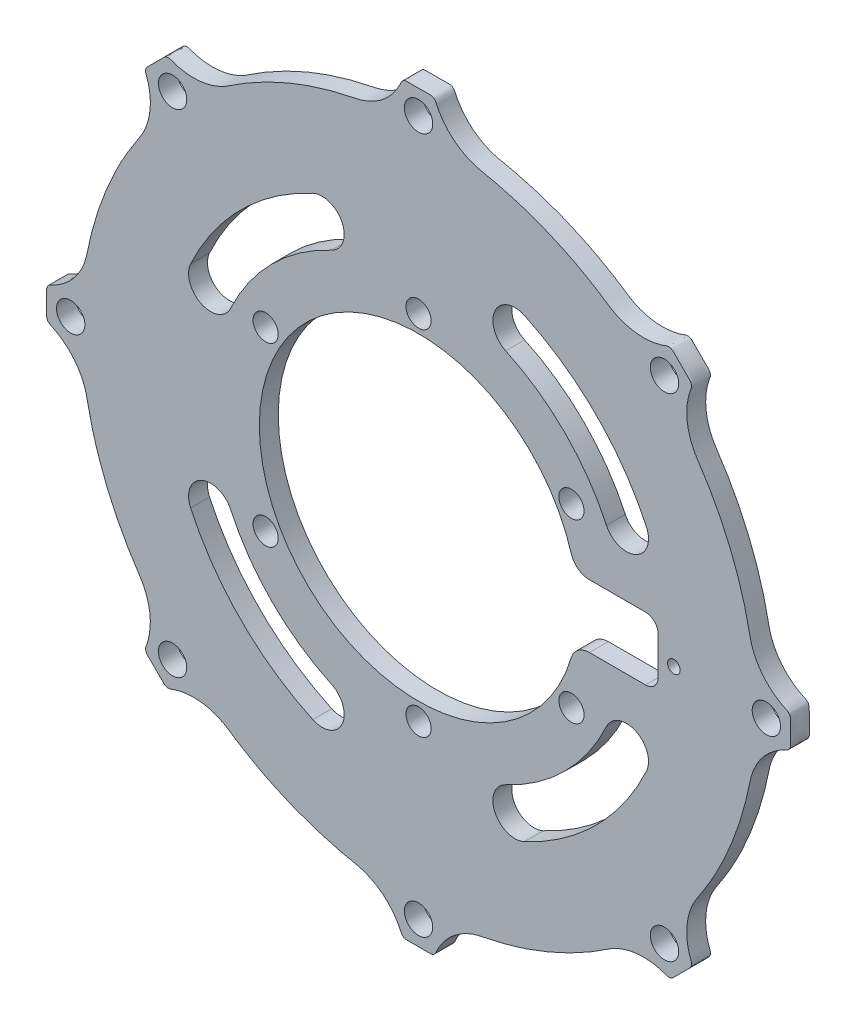
from build123d import *

# Parameters (mm, degrees)
SKETCH1_R                 = 1
BOSS_EXTRUDE1_DEPTH       = 3
F_4_0MM_DOWEL_HOLE1_D     = 4
F_4_0MM_DOWEL_HOLE1_DEPTH = 4
F_4_0MM_DOWEL_HOLE1_TIP   = 1.201721238
M4_CLEARANCE_HOLE1_D      = 4.5
M4_CLEARANCE_HOLE1_DEPTH  = 4
M4_CLEARANCE_HOLE1_TIP    = 1.351936393
SKETCH16_R                = 46.9
SKETCH16_R_2              = 45.6
BOSS_EXTRUDE2_DEPTH       = 1.35


with BuildPart() as part:
    # Sketch1 → Boss-Extrude1 (new body)
    with BuildSketch(Plane.XY):
        with BuildLine():
            add(Edge.make_bspline(
                [(-2.888569338, 58.090305414), (-3.904277799, 55.9452699), (-5.591838924, 54.27644442), (-7.748079959, 53.284746062), (-8.235225684, 53.060698004), (-9.245557382, 52.690963884), (-10.84227328, 52.398071486), (-11.889156148, 52.164983222), (-12.410727624, 52.040597997), (-17.936005436, 50.722920633), (-23.183850069, 48.549192213), (-28.022550078, 45.573969403), (-28.479310442, 45.293116312), (-29.384386709, 44.717676629), (-30.720541549, 43.79573419), (-31.696395448, 43.342763299), (-32.199285394, 43.156725154), (-34.52028494, 42.298099023), (-36.994919588, 42.319571853), (-39.300669877, 43.218345087), (-39.301071956, 43.218501816), (-39.301876093, 43.218815326), (-39.303082259, 43.219285695), (-39.303886295, 43.219599465), (-39.304288312, 43.21975635), (-39.304689349, 43.219912852), (-39.305491422, 43.220225856), (-39.306694532, 43.220695362), (-39.307496605, 43.221008367), (-39.307897642, 43.221164869), (-39.310303861, 43.222103881), (-39.31271008, 43.223042894), (-39.3151163, 43.223981906), (-39.315517337, 43.224138408), (-39.31631941, 43.224451412), (-39.317522519, 43.224920919), (-39.318324593, 43.225233923), (-39.318725629, 43.225390425), (-39.319128068, 43.225547474), (-39.319932946, 43.225861573), (-39.321141382, 43.226329852), (-39.321947274, 43.226641342), (-39.32235032, 43.226796825), (-39.599832465, 43.333841276), (-39.896638588, 43.314841774), (-40.158207362, 43.173290965), (-40.186385644, 43.158041979), (-40.241276486, 43.124835529), (-40.32140827, 43.068886213), (-40.366719354, 43.023575129), (-40.389374896, 43.000919586), (-40.412030438, 42.978264044), (-40.457341522, 42.93295296), (-40.525308148, 42.864986334), (-40.570619233, 42.81967525), (-40.593274775, 42.797019708), (-41.327856419, 42.062438063), (-42.062438063, 41.327856419), (-42.797019708, 40.593274775), (-42.81967525, 40.570619233), (-42.864986334, 40.525308148), (-42.93295296, 40.457341522), (-42.978264044, 40.412030438), (-43.000919586, 40.389374896), (-43.023575129, 40.366719354), (-43.068886213, 40.32140827), (-43.124835529, 40.241276486), (-43.158041979, 40.186385644), (-43.173290965, 40.158207362), (-43.314841774, 39.896638588), (-43.333841276, 39.599832465), (-43.226796825, 39.32235032), (-43.226641342, 39.321947274), (-43.226329852, 39.321141382), (-43.225861573, 39.319932946), (-43.225547474, 39.319128068), (-43.225390425, 39.318725629), (-43.225233923, 39.318324593), (-43.224920919, 39.317522519), (-43.224451412, 39.31631941), (-43.224138408, 39.315517337), (-43.223981906, 39.3151163), (-43.223042894, 39.31271008), (-43.222103881, 39.310303861), (-43.221164869, 39.307897642), (-43.221008367, 39.307496605), (-43.220695362, 39.306694532), (-43.220225856, 39.305491422), (-43.219912852, 39.304689349), (-43.21975635, 39.304288312), (-43.219599465, 39.303886294), (-43.219285695, 39.303082259), (-43.218815326, 39.301876093), (-43.218501816, 39.301071956), (-43.218345087, 39.300669877), (-42.319571853, 36.994919588), (-42.298099023, 34.52028494), (-43.156725154, 32.199285394), (-43.342763299, 31.696395448), (-43.79573419, 30.720541549), (-44.717676629, 29.384386709), (-45.293116312, 28.479310442), (-45.573969403, 28.022550078), (-48.549192213, 23.183850069), (-50.722920633, 17.936005436), (-52.040597997, 12.410727624), (-52.164983222, 11.889156148), (-52.398071486, 10.84227328), (-52.690963884, 9.245557382), (-53.060698004, 8.235225684), (-53.284746062, 7.748079959), (-54.31880022, 5.499745081), (-56.083814744, 3.765097724), (-58.349755058, 2.770214708), (-58.350150195, 2.770041219), (-58.350940491, 2.769694293), (-58.35212598, 2.769174006), (-58.352916388, 2.768827336), (-58.353311592, 2.768654001), (-58.353705831, 2.768481089), (-58.35449431, 2.768135265), (-58.355677028, 2.767616529), (-58.356465507, 2.767270705), (-58.356859746, 2.767097793), (-58.359225182, 2.766060321), (-58.361590618, 2.765022849), (-58.363956055, 2.763985377), (-58.364350294, 2.763812465), (-58.365138773, 2.763466641), (-58.366321491, 2.762947905), (-58.367109969, 2.762602081), (-58.367504209, 2.762429169), (-58.367899827, 2.762255652), (-58.368691063, 2.761908619), (-58.36987668, 2.761385249), (-58.370666787, 2.761035654), (-58.371061728, 2.7608606), (-58.642963091, 2.640342951), (-58.839402036, 2.417034653), (-58.924267553, 2.131986062), (-58.933409946, 2.101278346), (-58.948743127, 2.038984153), (-58.965842714, 1.942760285), (-58.965842714, 1.878680735), (-58.965842714, 1.84664096), (-58.965842714, 1.814601185), (-58.965842714, 1.750521635), (-58.965842714, 1.654402311), (-58.965842714, 1.590322761), (-58.965842714, 1.558282986), (-58.965842714, 0.519427662), (-58.965842714, -0.519427662), (-58.965842714, -1.558282986), (-58.965842714, -1.590322761), (-58.965842714, -1.654402311), (-58.965842714, -1.750521635), (-58.965842714, -1.814601185), (-58.965842714, -1.84664096), (-58.965842714, -1.878680735), (-58.965842714, -1.942760285), (-58.948743127, -2.038984153), (-58.933409946, -2.101278346), (-58.924267553, -2.131986062), (-58.839402036, -2.417034653), (-58.642963091, -2.640342951), (-58.371061728, -2.7608606), (-58.370666787, -2.761035654), (-58.36987668, -2.761385249), (-58.368691063, -2.761908619), (-58.367899827, -2.762255652), (-58.367504209, -2.762429169), (-58.367109969, -2.762602081), (-58.366321491, -2.762947905), (-58.365138773, -2.763466641), (-58.364350294, -2.763812465), (-58.363956055, -2.763985377), (-58.361590618, -2.765022849), (-58.359225182, -2.766060321), (-58.356859746, -2.767097793), (-58.356465507, -2.767270705), (-58.355677028, -2.767616529), (-58.35449431, -2.768135265), (-58.353705831, -2.768481089), (-58.353311592, -2.768654001), (-58.352916388, -2.768827336), (-58.35212598, -2.769174006), (-58.350940491, -2.769694293), (-58.350150195, -2.770041219), (-58.349755058, -2.770214708), (-56.083814744, -3.765097724), (-54.31880022, -5.499745081), (-53.284746062, -7.748079959), (-53.060698004, -8.235225684), (-52.690963884, -9.245557382), (-52.398071486, -10.84227328), (-52.164983222, -11.889156148), (-52.040597997, -12.410727624), (-50.722920633, -17.936005436), (-48.549192213, -23.183850069), (-45.573969403, -28.022550078), (-45.293116312, -28.479310442), (-44.717676629, -29.384386709), (-43.79573419, -30.720541549), (-43.342763299, -31.696395448), (-43.156725154, -32.199285394), (-42.298099023, -34.52028494), (-42.319571853, -36.994919588), (-43.218345087, -39.300669877), (-43.218501816, -39.301071956), (-43.218815326, -39.301876093), (-43.219285695, -39.303082259), (-43.219599465, -39.303886294), (-43.21975635, -39.304288312), (-43.219912852, -39.304689349), (-43.220225856, -39.305491422), (-43.220695362, -39.306694532), (-43.221008367, -39.307496605), (-43.221164869, -39.307897642), (-43.222103881, -39.310303861), (-43.223042894, -39.31271008), (-43.223981906, -39.3151163), (-43.224138408, -39.315517337), (-43.224451412, -39.31631941), (-43.224920919, -39.317522519), (-43.225233923, -39.318324593), (-43.225390425, -39.318725629), (-43.225547474, -39.319128068), (-43.225861573, -39.319932946), (-43.226329852, -39.321141382), (-43.226641342, -39.321947274), (-43.226796825, -39.32235032), (-43.333841276, -39.599832465), (-43.314841774, -39.896638588), (-43.173290965, -40.158207362), (-43.158041979, -40.186385644), (-43.124835529, -40.241276486), (-43.068886213, -40.32140827), (-43.023575129, -40.366719354), (-43.000919586, -40.389374896), (-42.978264044, -40.412030438), (-42.93295296, -40.457341522), (-42.864986334, -40.525308148), (-42.81967525, -40.570619233), (-42.797019708, -40.593274775), (-42.062438063, -41.327856419), (-41.327856419, -42.062438063), (-40.593274775, -42.797019708), (-40.570619233, -42.81967525), (-40.525308148, -42.864986334), (-40.457341522, -42.93295296), (-40.412030438, -42.978264044), (-40.389374896, -43.000919586), (-40.366719354, -43.023575129), (-40.32140827, -43.068886213), (-40.241276486, -43.124835529), (-40.186385644, -43.158041979), (-40.158207362, -43.173290965), (-39.896638588, -43.314841774), (-39.599832465, -43.333841276), (-39.32235032, -43.226796825), (-39.321947274, -43.226641342), (-39.321141382, -43.226329852), (-39.319932946, -43.225861573), (-39.319128068, -43.225547474), (-39.318725629, -43.225390425), (-39.318324593, -43.225233923), (-39.317522519, -43.224920919), (-39.31631941, -43.224451412), (-39.315517337, -43.224138408), (-39.3151163, -43.223981906), (-39.31271008, -43.223042894), (-39.310303861, -43.222103881), (-39.307897642, -43.221164869), (-39.307496605, -43.221008367), (-39.306694532, -43.220695362), (-39.305491422, -43.220225856), (-39.304689349, -43.219912852), (-39.304288312, -43.21975635), (-39.303886294, -43.219599465), (-39.303082259, -43.219285695), (-39.301876093, -43.218815326), (-39.301071956, -43.218501816), (-39.300669877, -43.218345087), (-36.994919588, -42.319571853), (-34.52028494, -42.298099023), (-32.199285394, -43.156725154), (-31.696395448, -43.342763299), (-30.720541549, -43.79573419), (-29.384386709, -44.717676629), (-28.479310442, -45.293116312), (-28.022550078, -45.573969403), (-23.183850069, -48.549192213), (-17.936005436, -50.722920633), (-12.410727624, -52.040597997), (-11.889156148, -52.164983222), (-10.84227328, -52.398071486), (-9.245557382, -52.690963884), (-8.235225684, -53.060698004), (-7.748079959, -53.284746062), (-5.499745081, -54.31880022), (-3.765097724, -56.083814744), (-2.770214708, -58.349755058), (-2.770041219, -58.350150195), (-2.769694293, -58.350940491), (-2.769174006, -58.35212598), (-2.768827336, -58.352916388), (-2.768654001, -58.353311592), (-2.768481089, -58.353705831), (-2.768135265, -58.35449431), (-2.767616529, -58.355677028), (-2.767270705, -58.356465507), (-2.767097793, -58.356859746), (-2.766060321, -58.359225182), (-2.765022849, -58.361590618), (-2.763985377, -58.363956055), (-2.763812465, -58.364350294), (-2.763466641, -58.365138773), (-2.762947905, -58.366321491), (-2.762602081, -58.367109969), (-2.762429169, -58.367504209), (-2.762255652, -58.367899827), (-2.761908619, -58.368691063), (-2.761385249, -58.36987668), (-2.761035654, -58.370666787), (-2.7608606, -58.371061728), (-2.640342951, -58.642963091), (-2.417034653, -58.839402036), (-2.131986062, -58.924267553), (-2.101278346, -58.933409946), (-2.038984153, -58.948743127), (-1.942760285, -58.965842714), (-1.878680735, -58.965842714), (-1.84664096, -58.965842714), (-1.814601185, -58.965842714), (-1.750521635, -58.965842714), (-1.654402311, -58.965842714), (-1.590322761, -58.965842714), (-1.558282986, -58.965842714), (-0.519427662, -58.965842714), (0.519427662, -58.965842714), (1.558282986, -58.965842714), (1.590322761, -58.965842714), (1.654402311, -58.965842714), (1.750521635, -58.965842714), (1.814601185, -58.965842714), (1.84664096, -58.965842714), (1.878680735, -58.965842714), (1.942760285, -58.965842714), (2.038984153, -58.948743127), (2.101278346, -58.933409946), (2.131986062, -58.924267553), (2.417034653, -58.839402036), (2.640342951, -58.642963091), (2.7608606, -58.371061728), (2.761035654, -58.370666787), (2.761385249, -58.36987668), (2.761908619, -58.368691063), (2.762255652, -58.367899827), (2.762429169, -58.367504209), (2.762602081, -58.367109969), (2.762947905, -58.366321491), (2.763466641, -58.365138773), (2.763812465, -58.364350294), (2.763985377, -58.363956055), (2.765022849, -58.361590618), (2.766060321, -58.359225182), (2.767097793, -58.356859746), (2.767270705, -58.356465507), (2.767616529, -58.355677028), (2.768135265, -58.35449431), (2.768481089, -58.353705831), (2.768654001, -58.353311592), (2.768827336, -58.352916388), (2.769174006, -58.35212598), (2.769694293, -58.350940491), (2.770041219, -58.350150195), (2.770214708, -58.349755058), (3.765097724, -56.083814744), (5.499745081, -54.31880022), (7.748079959, -53.284746062), (8.235225684, -53.060698004), (9.245557382, -52.690963884), (10.84227328, -52.398071486), (11.889156148, -52.164983222), (12.410727624, -52.040597997), (17.936005436, -50.722920633), (23.183850069, -48.549192213), (28.022550078, -45.573969403), (28.479310442, -45.293116312), (29.384386709, -44.717676629), (30.720541549, -43.79573419), (31.696395448, -43.342763299), (32.199285394, -43.156725154), (34.52028494, -42.298099023), (36.994919588, -42.319571853), (39.300669877, -43.218345087), (39.301071956, -43.218501816), (39.301876093, -43.218815326), (39.303082259, -43.219285695), (39.303886294, -43.219599465), (39.304288312, -43.21975635), (39.304689349, -43.219912852), (39.305491422, -43.220225856), (39.306694532, -43.220695362), (39.307496605, -43.221008367), (39.307897642, -43.221164869), (39.310303861, -43.222103881), (39.31271008, -43.223042894), (39.3151163, -43.223981906), (39.315517337, -43.224138408), (39.31631941, -43.224451412), (39.317522519, -43.224920919), (39.318324593, -43.225233923), (39.318725629, -43.225390425), (39.319128068, -43.225547474), (39.319932946, -43.225861573), (39.321141382, -43.226329852), (39.321947274, -43.226641342), (39.32235032, -43.226796825), (39.599832465, -43.333841276), (39.896638588, -43.314841774), (40.158207362, -43.173290965), (40.186385644, -43.158041979), (40.241276486, -43.124835529), (40.32140827, -43.068886213), (40.366719354, -43.023575129), (40.389374896, -43.000919586), (40.412030438, -42.978264044), (40.457341522, -42.93295296), (40.525308148, -42.864986334), (40.570619233, -42.81967525), (40.593274775, -42.797019708), (41.327856419, -42.062438063), (42.062438063, -41.327856419), (42.797019708, -40.593274775), (42.81967525, -40.570619233), (42.864986334, -40.525308148), (42.93295296, -40.457341522), (42.978264044, -40.412030438), (43.000919586, -40.389374896), (43.023575129, -40.366719354), (43.068886213, -40.32140827), (43.124835529, -40.241276486), (43.158041979, -40.186385644), (43.173290965, -40.158207362), (43.314841774, -39.896638588), (43.333841276, -39.599832465), (43.226796825, -39.32235032), (43.226641342, -39.321947274), (43.226329852, -39.321141382), (43.225861573, -39.319932946), (43.225547474, -39.319128068), (43.225390425, -39.318725629), (43.225233923, -39.318324593), (43.224920919, -39.317522519), (43.224451412, -39.31631941), (43.224138408, -39.315517337), (43.223981906, -39.3151163), (43.223042894, -39.31271008), (43.222103881, -39.310303861), (43.221164869, -39.307897642), (43.221008367, -39.307496605), (43.220695362, -39.306694532), (43.220225856, -39.305491422), (43.219912852, -39.304689349), (43.21975635, -39.304288312), (43.219599465, -39.303886294), (43.219285695, -39.303082259), (43.218815326, -39.301876093), (43.218501816, -39.301071956), (43.218345087, -39.300669877), (42.319571853, -36.994919588), (42.298099023, -34.52028494), (43.156725154, -32.199285394), (43.342763299, -31.696395448), (43.79573419, -30.720541549), (44.717676629, -29.384386709), (45.293116312, -28.479310442), (45.573969403, -28.022550078), (48.549192213, -23.183850069), (50.722920633, -17.936005436), (52.040597997, -12.410727624), (52.164983222, -11.889156148), (52.398071486, -10.84227328), (52.690963884, -9.245557382), (53.060698004, -8.235225684), (53.284746062, -7.748079959), (54.31880022, -5.499745081), (56.083814744, -3.765097724), (58.349755058, -2.770214708), (58.350150195, -2.770041219), (58.350940491, -2.769694293), (58.35212598, -2.769174006), (58.352916388, -2.768827336), (58.353311592, -2.768654001), (58.353705831, -2.768481089), (58.35449431, -2.768135265), (58.355677028, -2.767616529), (58.356465507, -2.767270705), (58.356859746, -2.767097793), (58.359225182, -2.766060321), (58.361590618, -2.765022849), (58.363956055, -2.763985377), (58.364350294, -2.763812465), (58.365138773, -2.763466641), (58.366321491, -2.762947905), (58.367109969, -2.762602081), (58.367504209, -2.762429169), (58.367899827, -2.762255652), (58.368691063, -2.761908619), (58.36987668, -2.761385249), (58.370666787, -2.761035654), (58.371061728, -2.7608606), (58.642963091, -2.640342951), (58.839402036, -2.417034653), (58.924267553, -2.131986062), (58.933409946, -2.101278346), (58.948743127, -2.038984153), (58.965842714, -1.942760285), (58.965842714, -1.878680735), (58.965842714, -1.84664096), (58.965842714, -1.814601185), (58.965842714, -1.750521635), (58.965842714, -1.654402311), (58.965842714, -1.590322761), (58.965842714, -1.558282986), (58.965842714, -0.519427662), (58.965842714, 0.519427662), (58.965842714, 1.558282986), (58.965842714, 1.590322761), (58.965842714, 1.654402311), (58.965842714, 1.750521635), (58.965842714, 1.814601185), (58.965842714, 1.84664096), (58.965842714, 1.878680735), (58.965842714, 1.942760285), (58.948743127, 2.038984153), (58.933409946, 2.101278346), (58.924267553, 2.131986062), (58.839402036, 2.417034653), (58.642963091, 2.640342951), (58.371061728, 2.7608606), (58.370666787, 2.761035654), (58.36987668, 2.761385249), (58.368691063, 2.761908619), (58.367899827, 2.762255652), (58.367504209, 2.762429169), (58.367109969, 2.762602081), (58.366321491, 2.762947905), (58.365138773, 2.763466641), (58.364350294, 2.763812465), (58.363956055, 2.763985377), (58.361590618, 2.765022849), (58.359225182, 2.766060321), (58.356859746, 2.767097793), (58.356465507, 2.767270705), (58.355677028, 2.767616529), (58.35449431, 2.768135265), (58.353705831, 2.768481089), (58.353311592, 2.768654001), (58.352916388, 2.768827336), (58.35212598, 2.769174006), (58.350940491, 2.769694293), (58.350150195, 2.770041219), (58.349755058, 2.770214708), (56.083814744, 3.765097724), (54.31880022, 5.499745081), (53.284746062, 7.748079959), (53.060698004, 8.235225684), (52.690963884, 9.245557382), (52.398071486, 10.84227328), (52.164983222, 11.889156148), (52.040597997, 12.410727624), (50.722920633, 17.936005436), (48.549192213, 23.183850069), (45.573969403, 28.022550078), (45.293116312, 28.479310442), (44.717676629, 29.384386709), (43.79573419, 30.720541549), (43.342763299, 31.696395448), (43.156725154, 32.199285394), (42.298099023, 34.52028494), (42.319571853, 36.994919588), (43.218345087, 39.300669877), (43.218501816, 39.301071956), (43.218815326, 39.301876093), (43.219285695, 39.303082259), (43.219599465, 39.303886294), (43.21975635, 39.304288312), (43.219912852, 39.304689349), (43.220225856, 39.305491422), (43.220695362, 39.306694532), (43.221008367, 39.307496605), (43.221164869, 39.307897642), (43.222103881, 39.310303861), (43.223042894, 39.31271008), (43.223981906, 39.3151163), (43.224138408, 39.315517337), (43.224451412, 39.31631941), (43.224920919, 39.317522519), (43.225233923, 39.318324593), (43.225390425, 39.318725629), (43.225547474, 39.319128068), (43.225861573, 39.319932946), (43.226329852, 39.321141382), (43.226641342, 39.321947274), (43.226796825, 39.32235032), (43.333841276, 39.599832465), (43.314841774, 39.896638588), (43.173290965, 40.158207362), (43.158041979, 40.186385644), (43.124835529, 40.241276486), (43.068886213, 40.32140827), (43.023575129, 40.366719354), (43.000919586, 40.389374896), (42.978264044, 40.412030438), (42.93295296, 40.457341522), (42.864986334, 40.525308148), (42.81967525, 40.570619233), (42.797019708, 40.593274775), (42.062438063, 41.327856419), (41.327856419, 42.062438063), (40.593274775, 42.797019708), (40.570619233, 42.81967525), (40.525308148, 42.864986334), (40.457341522, 42.93295296), (40.412030438, 42.978264044), (40.389374896, 43.000919586), (40.366719354, 43.023575129), (40.32140827, 43.068886213), (40.241276486, 43.124835529), (40.186385644, 43.158041979), (40.158207362, 43.173290965), (39.896638588, 43.314841774), (39.599832465, 43.333841276), (39.32235032, 43.226796825), (39.321947274, 43.226641342), (39.321141382, 43.226329852), (39.319932946, 43.225861573), (39.319128068, 43.225547474), (39.318725629, 43.225390425), (39.318324593, 43.225233923), (39.317522519, 43.224920919), (39.31631941, 43.224451412), (39.315517337, 43.224138408), (39.3151163, 43.223981906), (39.31271008, 43.223042894), (39.310303861, 43.222103881), (39.307897642, 43.221164869), (39.307496605, 43.221008367), (39.306694532, 43.220695362), (39.305491422, 43.220225856), (39.304689349, 43.219912852), (39.304288312, 43.21975635), (39.303886294, 43.219599465), (39.303082259, 43.219285695), (39.301876093, 43.218815326), (39.301071956, 43.218501816), (39.300669877, 43.218345087), (36.994919588, 42.319571853), (34.52028494, 42.298099023), (32.199285394, 43.156725154), (31.696395448, 43.342763299), (30.720541549, 43.79573419), (29.384386709, 44.717676629), (28.479310442, 45.293116312), (28.022550078, 45.573969403), (23.183850069, 48.549192213), (17.936005436, 50.722920633), (12.410727624, 52.040597997), (11.889156148, 52.164983222), (10.84227328, 52.398071486), (9.245557382, 52.690963884), (8.235225684, 53.060698004), (7.748079959, 53.284746062), (5.591838924, 54.27644442), (3.904277799, 55.9452699), (2.888569338, 58.090305414), (2.86043616, 58.149718786), (2.805341513, 58.269100351), (2.727304111, 58.453248868), (2.652227716, 58.561956296), (2.609742987, 58.612120747), (2.483296792, 58.761423899), (2.319504695, 58.868438946), (2.131986062, 58.924267553), (2.101278346, 58.933409946), (2.038984153, 58.948743127), (1.942760285, 58.965842714), (1.878680735, 58.965842714), (1.84664096, 58.965842714), (1.814601185, 58.965842714), (1.750521635, 58.965842714), (1.654402311, 58.965842714), (1.590322761, 58.965842714), (1.558282986, 58.965842714), (0.519427662, 58.965842714), (-0.519427662, 58.965842714), (-1.558282986, 58.965842714), (-1.590322761, 58.965842714), (-1.654402311, 58.965842714), (-1.750521635, 58.965842714), (-1.814601185, 58.965842714), (-1.84664096, 58.965842714), (-1.878680735, 58.965842714), (-1.942760285, 58.965842714), (-2.038984153, 58.948743127), (-2.101278346, 58.933409946), (-2.131986062, 58.924267553), (-2.319504695, 58.868438946), (-2.483296792, 58.761423899), (-2.609742987, 58.612120747), (-2.652227716, 58.561956296), (-2.727304111, 58.453248868), (-2.805341513, 58.269100351), (-2.86043616, 58.149718786), (-2.888569338, 58.090305414)],
                knots=[0, 0, 0, 0, 0.018272392, 0.018272392, 0.018272392, 0.022573152, 0.026873912, 0.031174673, 0.031174673, 0.031174673, 0.076353702, 0.076353702, 0.076353702, 0.080654462, 0.084955222, 0.089255982, 0.089255982, 0.089255982, 0.108243055, 0.108243055, 0.108243055, 0.108246516, 0.108249978, 0.108253439, 0.108253439, 0.108253439, 0.108256892, 0.108260345, 0.108263798, 0.108263798, 0.108263798, 0.108284515, 0.108284515, 0.108284515, 0.108287968, 0.108291421, 0.108294874, 0.108294874, 0.108294874, 0.108298339, 0.108301804, 0.108305269, 0.108305269, 0.108305269, 0.110544601, 0.110544601, 0.110544601, 0.110801587, 0.111058573, 0.111315559, 0.111315559, 0.111315559, 0.111572545, 0.111829531, 0.112086517, 0.112086517, 0.112086517, 0.12041901, 0.12041901, 0.12041901, 0.120675996, 0.120932982, 0.121189968, 0.121189968, 0.121189968, 0.121446954, 0.12170394, 0.121960926, 0.121960926, 0.121960926, 0.124200258, 0.124200258, 0.124200258, 0.124203723, 0.124207188, 0.124210653, 0.124210653, 0.124210653, 0.124214106, 0.124217559, 0.124221012, 0.124221012, 0.124221012, 0.124241729, 0.124241729, 0.124241729, 0.124245182, 0.124248635, 0.124252088, 0.124252088, 0.124252088, 0.12425555, 0.124259011, 0.124262472, 0.124262472, 0.124262472, 0.143249545, 0.143249545, 0.143249545, 0.147550305, 0.151851065, 0.156151825, 0.156151825, 0.156151825, 0.201330854, 0.201330854, 0.201330854, 0.205631615, 0.209932375, 0.214233135, 0.214233135, 0.214233135, 0.233220208, 0.233220208, 0.233220208, 0.233223669, 0.23322713, 0.233230592, 0.233230592, 0.233230592, 0.233234045, 0.233237497, 0.23324095, 0.23324095, 0.23324095, 0.233261668, 0.233261668, 0.233261668, 0.233265121, 0.233268574, 0.233272027, 0.233272027, 0.233272027, 0.233275492, 0.233278957, 0.233282421, 0.233282421, 0.233282421, 0.235521754, 0.235521754, 0.235521754, 0.23577874, 0.236035726, 0.236292712, 0.236292712, 0.236292712, 0.236549698, 0.236806684, 0.23706367, 0.23706367, 0.23706367, 0.245396163, 0.245396163, 0.245396163, 0.245653149, 0.245910135, 0.246167121, 0.246167121, 0.246167121, 0.246424107, 0.246681092, 0.246938078, 0.246938078, 0.246938078, 0.249177411, 0.249177411, 0.249177411, 0.249180876, 0.249184341, 0.249187806, 0.249187806, 0.249187806, 0.249191259, 0.249194712, 0.249198165, 0.249198165, 0.249198165, 0.249218882, 0.249218882, 0.249218882, 0.249222335, 0.249225788, 0.249229241, 0.249229241, 0.249229241, 0.249232702, 0.249236164, 0.249239625, 0.249239625, 0.249239625, 0.268226698, 0.268226698, 0.268226698, 0.272527458, 0.276828218, 0.281128978, 0.281128978, 0.281128978, 0.326308007, 0.326308007, 0.326308007, 0.330608767, 0.334909528, 0.339210288, 0.339210288, 0.339210288, 0.35819736, 0.35819736, 0.35819736, 0.358200822, 0.358204283, 0.358207744, 0.358207744, 0.358207744, 0.358211197, 0.35821465, 0.358218103, 0.358218103, 0.358218103, 0.358238821, 0.358238821, 0.358238821, 0.358242273, 0.358245726, 0.358249179, 0.358249179, 0.358249179, 0.358252644, 0.358256109, 0.358259574, 0.358259574, 0.358259574, 0.360498907, 0.360498907, 0.360498907, 0.360755893, 0.361012879, 0.361269865, 0.361269865, 0.361269865, 0.361526851, 0.361783837, 0.362040823, 0.362040823, 0.362040823, 0.370373316, 0.370373316, 0.370373316, 0.370630301, 0.370887287, 0.371144273, 0.371144273, 0.371144273, 0.371401259, 0.371658245, 0.371915231, 0.371915231, 0.371915231, 0.374154564, 0.374154564, 0.374154564, 0.374158029, 0.374161494, 0.374164959, 0.374164959, 0.374164959, 0.374168412, 0.374171865, 0.374175318, 0.374175318, 0.374175318, 0.374196035, 0.374196035, 0.374196035, 0.374199488, 0.374202941, 0.374206394, 0.374206394, 0.374206394, 0.374209855, 0.374213316, 0.374216778, 0.374216778, 0.374216778, 0.39320385, 0.39320385, 0.39320385, 0.397504611, 0.401805371, 0.406106131, 0.406106131, 0.406106131, 0.45128516, 0.45128516, 0.45128516, 0.45558592, 0.45988668, 0.46418744, 0.46418744, 0.46418744, 0.483174513, 0.483174513, 0.483174513, 0.483177974, 0.483181436, 0.483184897, 0.483184897, 0.483184897, 0.48318835, 0.483191803, 0.483195256, 0.483195256, 0.483195256, 0.483215973, 0.483215973, 0.483215973, 0.483219426, 0.483222879, 0.483226332, 0.483226332, 0.483226332, 0.483229797, 0.483233262, 0.483236727, 0.483236727, 0.483236727, 0.48547606, 0.48547606, 0.48547606, 0.485733046, 0.485990032, 0.486247017, 0.486247017, 0.486247017, 0.486504003, 0.486760989, 0.487017975, 0.487017975, 0.487017975, 0.495350468, 0.495350468, 0.495350468, 0.495607454, 0.49586444, 0.496121426, 0.496121426, 0.496121426, 0.496378412, 0.496635398, 0.496892384, 0.496892384, 0.496892384, 0.499131717, 0.499131717, 0.499131717, 0.499135182, 0.499138647, 0.499142112, 0.499142112, 0.499142112, 0.499145564, 0.499149017, 0.49915247, 0.49915247, 0.49915247, 0.499173188, 0.499173188, 0.499173188, 0.499176641, 0.499180094, 0.499183546, 0.499183546, 0.499183546, 0.499187008, 0.499190469, 0.49919393, 0.49919393, 0.49919393, 0.518181003, 0.518181003, 0.518181003, 0.522481763, 0.526782523, 0.531083284, 0.531083284, 0.531083284, 0.576262313, 0.576262313, 0.576262313, 0.580563073, 0.584863833, 0.589164593, 0.589164593, 0.589164593, 0.608151666, 0.608151666, 0.608151666, 0.608155127, 0.608158589, 0.60816205, 0.60816205, 0.60816205, 0.608165503, 0.608168956, 0.608172409, 0.608172409, 0.608172409, 0.608193126, 0.608193126, 0.608193126, 0.608196579, 0.608200032, 0.608203485, 0.608203485, 0.608203485, 0.60820695, 0.608210415, 0.60821388, 0.60821388, 0.60821388, 0.610453212, 0.610453212, 0.610453212, 0.610710198, 0.610967184, 0.61122417, 0.61122417, 0.61122417, 0.611481156, 0.611738142, 0.611995128, 0.611995128, 0.611995128, 0.620327621, 0.620327621, 0.620327621, 0.620584607, 0.620841593, 0.621098579, 0.621098579, 0.621098579, 0.621355565, 0.621612551, 0.621869537, 0.621869537, 0.621869537, 0.624108869, 0.624108869, 0.624108869, 0.624112334, 0.624115799, 0.624119264, 0.624119264, 0.624119264, 0.624122717, 0.62412617, 0.624129623, 0.624129623, 0.624129623, 0.62415034, 0.62415034, 0.62415034, 0.624153793, 0.624157246, 0.624160699, 0.624160699, 0.624160699, 0.624164161, 0.624167622, 0.624171083, 0.624171083, 0.624171083, 0.643158156, 0.643158156, 0.643158156, 0.647458916, 0.651759676, 0.656060436, 0.656060436, 0.656060436, 0.701239465, 0.701239465, 0.701239465, 0.705540226, 0.709840986, 0.714141746, 0.714141746, 0.714141746, 0.733128819, 0.733128819, 0.733128819, 0.73313228, 0.733135741, 0.733139203, 0.733139203, 0.733139203, 0.733142656, 0.733146108, 0.733149561, 0.733149561, 0.733149561, 0.733170279, 0.733170279, 0.733170279, 0.733173732, 0.733177185, 0.733180638, 0.733180638, 0.733180638, 0.733184103, 0.733187567, 0.733191032, 0.733191032, 0.733191032, 0.735430365, 0.735430365, 0.735430365, 0.735687351, 0.735944337, 0.736201323, 0.736201323, 0.736201323, 0.736458309, 0.736715295, 0.736972281, 0.736972281, 0.736972281, 0.745304774, 0.745304774, 0.745304774, 0.74556176, 0.745818746, 0.746075732, 0.746075732, 0.746075732, 0.746332718, 0.746589703, 0.746846689, 0.746846689, 0.746846689, 0.749086022, 0.749086022, 0.749086022, 0.749089487, 0.749092952, 0.749096417, 0.749096417, 0.749096417, 0.74909987, 0.749103323, 0.749106776, 0.749106776, 0.749106776, 0.749127493, 0.749127493, 0.749127493, 0.749130946, 0.749134399, 0.749137852, 0.749137852, 0.749137852, 0.749141313, 0.749144775, 0.749148236, 0.749148236, 0.749148236, 0.768135309, 0.768135309, 0.768135309, 0.772436069, 0.776736829, 0.781037589, 0.781037589, 0.781037589, 0.826216618, 0.826216618, 0.826216618, 0.830517378, 0.834818139, 0.839118899, 0.839118899, 0.839118899, 0.858105971, 0.858105971, 0.858105971, 0.858109433, 0.858112894, 0.858116355, 0.858116355, 0.858116355, 0.858119808, 0.858123261, 0.858126714, 0.858126714, 0.858126714, 0.858147432, 0.858147432, 0.858147432, 0.858150884, 0.858154337, 0.85815779, 0.85815779, 0.85815779, 0.858161255, 0.85816472, 0.858168185, 0.858168185, 0.858168185, 0.860407518, 0.860407518, 0.860407518, 0.860664504, 0.86092149, 0.861178476, 0.861178476, 0.861178476, 0.861435462, 0.861692448, 0.861949434, 0.861949434, 0.861949434, 0.870281927, 0.870281927, 0.870281927, 0.870538912, 0.870795898, 0.871052884, 0.871052884, 0.871052884, 0.87130987, 0.871566856, 0.871823842, 0.871823842, 0.871823842, 0.874063175, 0.874063175, 0.874063175, 0.87406664, 0.874070105, 0.87407357, 0.87407357, 0.87407357, 0.874077023, 0.874080476, 0.874083928, 0.874083928, 0.874083928, 0.874104646, 0.874104646, 0.874104646, 0.874108099, 0.874111552, 0.874115005, 0.874115005, 0.874115005, 0.874118466, 0.874121927, 0.874125389, 0.874125389, 0.874125389, 0.893112461, 0.893112461, 0.893112461, 0.897413222, 0.901713982, 0.906014742, 0.906014742, 0.906014742, 0.951193771, 0.951193771, 0.951193771, 0.955494531, 0.959795291, 0.964096051, 0.964096051, 0.964096051, 0.982368444, 0.982368444, 0.982368444, 0.982895714, 0.983422984, 0.983950255, 0.983950255, 0.983950255, 0.98547606, 0.98547606, 0.98547606, 0.985733046, 0.985990032, 0.986247017, 0.986247017, 0.986247017, 0.986504003, 0.986760989, 0.987017975, 0.987017975, 0.987017975, 0.995350468, 0.995350468, 0.995350468, 0.995607454, 0.99586444, 0.996121426, 0.996121426, 0.996121426, 0.996378412, 0.996635398, 0.996892384, 0.996892384, 0.996892384, 0.998418189, 0.998418189, 0.998418189, 0.998945459, 0.99947273, 1, 1, 1, 1], degree=3, weights=[1, 0.959868564, 0.959868564, 1, 1, 1, 1, 1, 1, 0.991633934, 0.991633934, 1, 1, 1, 1, 1, 1, 0.956556623, 0.956556623, 1, 1, 1, 1, 1, 1, 1, 1, 1, 1, 1, 1, 1, 1, 1, 1, 1, 1, 1, 1, 1, 1, 1, 1, 0.938723945, 0.938723945, 1, 1, 1, 1, 1, 1, 1, 1, 1, 1, 1, 1, 1, 1, 1, 1, 1, 1, 1, 1, 1, 1, 1, 1, 0.938723945, 0.938723945, 1, 1, 1, 1, 1, 1, 1, 1, 1, 1, 1, 1, 1, 1, 1, 1, 1, 1, 1, 1, 1, 1, 1, 1, 0.956556623, 0.956556623, 1, 1, 1, 1, 1, 1, 0.991633934, 0.991633934, 1, 1, 1, 1, 1, 1, 0.956556623, 0.956556623, 1, 1, 1, 1, 1, 1, 1, 1, 1, 1, 1, 1, 1, 1, 1, 1, 1, 1, 1, 1, 1, 1, 1, 1, 0.938723945, 0.938723945, 1, 1, 1, 1, 1, 1, 1, 1, 1, 1, 1, 1, 1, 1, 1, 1, 1, 1, 1, 1, 1, 1, 1, 1, 0.938723945, 0.938723945, 1, 1, 1, 1, 1, 1, 1, 1, 1, 1, 1, 1, 1, 1, 1, 1, 1, 1, 1, 1, 1, 1, 1, 1, 0.956556623, 0.956556623, 1, 1, 1, 1, 1, 1, 0.991633934, 0.991633934, 1, 1, 1, 1, 1, 1, 0.956556623, 0.956556623, 1, 1, 1, 1, 1, 1, 1, 1, 1, 1, 1, 1, 1, 1, 1, 1, 1, 1, 1, 1, 1, 1, 1, 1, 0.938723945, 0.938723945, 1, 1, 1, 1, 1, 1, 1, 1, 1, 1, 1, 1, 1, 1, 1, 1, 1, 1, 1, 1, 1, 1, 1, 1, 0.938723945, 0.938723945, 1, 1, 1, 1, 1, 1, 1, 1, 1, 1, 1, 1, 1, 1, 1, 1, 1, 1, 1, 1, 1, 1, 1, 1, 0.956556623, 0.956556623, 1, 1, 1, 1, 1, 1, 0.991633934, 0.991633934, 1, 1, 1, 1, 1, 1, 0.956556623, 0.956556623, 1, 1, 1, 1, 1, 1, 1, 1, 1, 1, 1, 1, 1, 1, 1, 1, 1, 1, 1, 1, 1, 1, 1, 1, 0.938723945, 0.938723945, 1, 1, 1, 1, 1, 1, 1, 1, 1, 1, 1, 1, 1, 1, 1, 1, 1, 1, 1, 1, 1, 1, 1, 1, 0.938723945, 0.938723945, 1, 1, 1, 1, 1, 1, 1, 1, 1, 1, 1, 1, 1, 1, 1, 1, 1, 1, 1, 1, 1, 1, 1, 1, 0.956556623, 0.956556623, 1, 1, 1, 1, 1, 1, 0.991633934, 0.991633934, 1, 1, 1, 1, 1, 1, 0.956556623, 0.956556623, 1, 1, 1, 1, 1, 1, 1, 1, 1, 1, 1, 1, 1, 1, 1, 1, 1, 1, 1, 1, 1, 1, 1, 1, 0.938723945, 0.938723945, 1, 1, 1, 1, 1, 1, 1, 1, 1, 1, 1, 1, 1, 1, 1, 1, 1, 1, 1, 1, 1, 1, 1, 1, 0.938723945, 0.938723945, 1, 1, 1, 1, 1, 1, 1, 1, 1, 1, 1, 1, 1, 1, 1, 1, 1, 1, 1, 1, 1, 1, 1, 1, 0.956556623, 0.956556623, 1, 1, 1, 1, 1, 1, 0.991633934, 0.991633934, 1, 1, 1, 1, 1, 1, 0.956556623, 0.956556623, 1, 1, 1, 1, 1, 1, 1, 1, 1, 1, 1, 1, 1, 1, 1, 1, 1, 1, 1, 1, 1, 1, 1, 1, 0.938723945, 0.938723945, 1, 1, 1, 1, 1, 1, 1, 1, 1, 1, 1, 1, 1, 1, 1, 1, 1, 1, 1, 1, 1, 1, 1, 1, 0.938723945, 0.938723945, 1, 1, 1, 1, 1, 1, 1, 1, 1, 1, 1, 1, 1, 1, 1, 1, 1, 1, 1, 1, 1, 1, 1, 1, 0.956556623, 0.956556623, 1, 1, 1, 1, 1, 1, 0.991633934, 0.991633934, 1, 1, 1, 1, 1, 1, 0.956556623, 0.956556623, 1, 1, 1, 1, 1, 1, 1, 1, 1, 1, 1, 1, 1, 1, 1, 1, 1, 1, 1, 1, 1, 1, 1, 1, 0.938723945, 0.938723945, 1, 1, 1, 1, 1, 1, 1, 1, 1, 1, 1, 1, 1, 1, 1, 1, 1, 1, 1, 1, 1, 1, 1, 1, 0.938723945, 0.938723945, 1, 1, 1, 1, 1, 1, 1, 1, 1, 1, 1, 1, 1, 1, 1, 1, 1, 1, 1, 1, 1, 1, 1, 1, 0.956556623, 0.956556623, 1, 1, 1, 1, 1, 1, 0.991633934, 0.991633934, 1, 1, 1, 1, 1, 1, 0.959868564, 0.959868564, 1, 1, 1, 1, 1, 1, 0.972283226, 0.972283226, 1, 1, 1, 1, 1, 1, 1, 1, 1, 1, 1, 1, 1, 1, 1, 1, 1, 1, 1, 1, 1, 1, 1, 1, 0.972283226, 0.972283226, 1, 1, 1, 1, 1, 1]))
        make_face()
        with Locations((40.499304298, -0.237384428)):
            Circle(SKETCH1_R, mode=Mode.SUBTRACT)
        with BuildLine():
            Line((38, -3), (38, 3))
            ThreePointArc((38, 3), (37.414213562, 4.414213562), (36, 5))
            Line((36, 5), (27.093587802, 5))
            ThreePointArc((27.093587802, 5), (25.297574518, 5.59701513), (24.216392637, 7.150442478))
            ThreePointArc((24.216392637, 7.150442478), (-25.25, 0), (24.216392637, -7.150442478))
            ThreePointArc((24.216392637, -7.150442478), (25.297574518, -5.59701513), (27.093587802, -5))
            Line((27.093587802, -5), (36, -5))
            ThreePointArc((36, -5), (37.414213562, -4.414213562), (38, -3))
        make_face(mode=Mode.SUBTRACT)
        with BuildLine():
            ThreePointArc((36.146345677, 16.766354404), (28.175068286, 28.175068286), (16.766354404, 36.146345677))
            ThreePointArc((16.766354404, 36.146345677), (12.118548397, 34.444023934), (13.82087014, 29.796217927))
            ThreePointArc((13.82087014, 29.796217927), (23.225320818, 23.225320818), (29.796217927, 13.82087014))
            ThreePointArc((29.796217927, 13.82087014), (34.444023934, 12.118548397), (36.146345677, 16.766354404))
        make_face(mode=Mode.SUBTRACT)
        with BuildLine():
            ThreePointArc((16.766354404, -36.146345677), (28.175068286, -28.175068286), (36.146345677, -16.766354404))
            ThreePointArc((36.146345677, -16.766354404), (34.444023934, -12.118548397), (29.796217927, -13.82087014))
            ThreePointArc((29.796217927, -13.82087014), (23.225320818, -23.225320818), (13.82087014, -29.796217927))
            ThreePointArc((13.82087014, -29.796217927), (12.118548397, -34.444023934), (16.766354404, -36.146345677))
        make_face(mode=Mode.SUBTRACT)
        with BuildLine():
            ThreePointArc((-36.146345677, -16.766354404), (-28.175068286, -28.175068286), (-16.766354404, -36.146345677))
            ThreePointArc((-16.766354404, -36.146345677), (-12.118548397, -34.444023934), (-13.82087014, -29.796217927))
            ThreePointArc((-13.82087014, -29.796217927), (-23.225320818, -23.225320818), (-29.796217927, -13.82087014))
            ThreePointArc((-29.796217927, -13.82087014), (-34.444023934, -12.118548397), (-36.146345677, -16.766354404))
        make_face(mode=Mode.SUBTRACT)
        with BuildLine():
            ThreePointArc((-16.766354404, 36.146345677), (-28.175068286, 28.175068286), (-36.146345677, 16.766354404))
            ThreePointArc((-36.146345677, 16.766354404), (-34.444023934, 12.118548397), (-29.796217927, 13.82087014))
            ThreePointArc((-29.796217927, 13.82087014), (-23.225320818, 23.225320818), (-13.82087014, 29.796217927))
            ThreePointArc((-13.82087014, 29.796217927), (-12.118548397, 34.444023934), (-16.766354404, 36.146345677))
        make_face(mode=Mode.SUBTRACT)
    extrude(amount=BOSS_EXTRUDE1_DEPTH)

    # Ø4.0mm Dowel Hole1
    with Locations(Plane.XY.offset(3)):
        with Locations((0, 28), (24.248711306, 14), (24.248711306, -14), (0, -28), (-24.248711306, -14), (-24.248711306, 14)):
            Hole(F_4_0MM_DOWEL_HOLE1_D / 2, depth=F_4_0MM_DOWEL_HOLE1_DEPTH)
            with Locations((0, 0, -(F_4_0MM_DOWEL_HOLE1_DEPTH + F_4_0MM_DOWEL_HOLE1_TIP / 2))):  # 118° drill point
                Cone(0, F_4_0MM_DOWEL_HOLE1_D / 2, F_4_0MM_DOWEL_HOLE1_TIP, mode=Mode.SUBTRACT)

    # M4 Clearance Hole1
    with Locations(Plane.XY.offset(3)):
        with Locations((0, 55.165842714), (-39.008141473, 39.008141473), (39.008141473, 39.008141473), (55.165842714, 0), (39.008141473, -39.008141473), (-55.165842714, 0), (-39.008141473, -39.008141473), (0, -55.165842714)):
            Hole(M4_CLEARANCE_HOLE1_D / 2, depth=M4_CLEARANCE_HOLE1_DEPTH)
            with Locations((0, 0, -(M4_CLEARANCE_HOLE1_DEPTH + M4_CLEARANCE_HOLE1_TIP / 2))):  # 118° drill point
                Cone(0, M4_CLEARANCE_HOLE1_D / 2, M4_CLEARANCE_HOLE1_TIP, mode=Mode.SUBTRACT)

    # Sketch16 → Boss-Extrude2 (add)
    with BuildSketch(Plane.XY):
        Circle(SKETCH16_R)
        Circle(SKETCH16_R_2, mode=Mode.SUBTRACT)
    extrude(amount=-BOSS_EXTRUDE2_DEPTH)


solid = part.part
